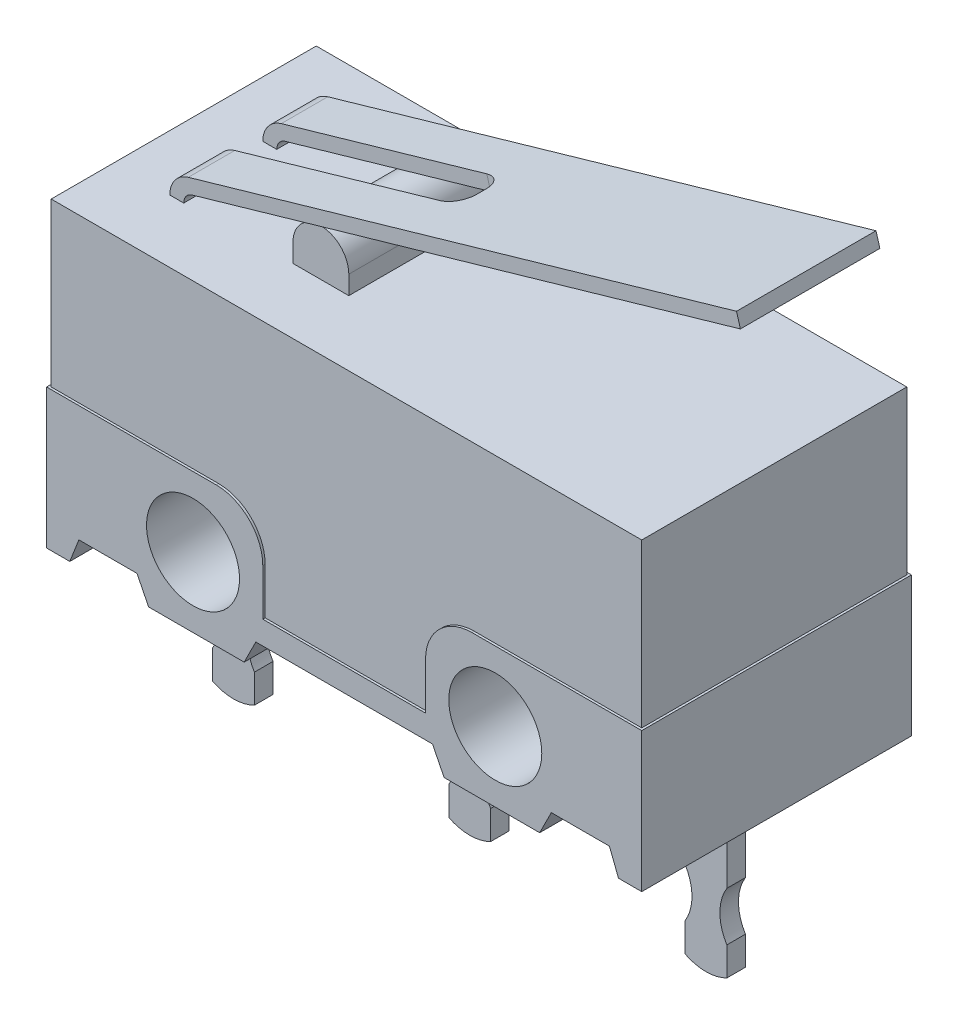
from build123d import *

# Parameters (mm, degrees)
SKETCH1_R             = 1
BOSS_EXTRUDE1_DEPTH   = 2.9
BOSS_EXTRUDE2_START   = -2.9
BOSS_EXTRUDE2_DEPTH   = 2.85
CUT_EXTRUDE1_DEPTH    = 10.97997996
BOSS_EXTRUDE3_DEPTH   = 0.2
BOSS_EXTRUDE3_2_DEPTH = 0.2
BOSS_EXTRUDE3_3_DEPTH = 0.2
BOSS_EXTRUDE4_START   = -2.85
BOSS_EXTRUDE4_DEPTH   = 1.45
BOSS_EXTRUDE5_START   = -2.85
BOSS_EXTRUDE5_DEPTH   = 1.5
CUT_EXTRUDE2_DEPTH    = 15.762153366


with BuildPart() as part:
    # Sketch1 → Boss-Extrude1 (new, symmetric)
    with BuildSketch(Plane.XY):
        with BuildLine():
            Line((6.4, -1.5), (-6.4, -1.5))
            Line((-6.4, -1.5), (-6.4, 1.5))
            Line((-6.4, 1.5), (-2.75, 1.5))
            ThreePointArc((-2.75, 1.5), (-2.042893219, 1.207106781), (-1.75, 0.5))
            Line((-1.75, 0.5), (-1.75, -0.5))
            Line((-1.75, -0.5), (1.75, -0.5))
            Line((1.75, -0.5), (1.75, 0.5))
            ThreePointArc((1.75, 0.5), (2.042893219, 1.207106781), (2.75, 1.5))
            Line((2.75, 1.5), (6.4, 1.5))
            Line((6.4, 1.5), (6.4, -1.5))
        make_face()
        with Locations((-3.25, 0)):
            Circle(SKETCH1_R, mode=Mode.SUBTRACT)
        with Locations((3.25, 0)):
            Circle(SKETCH1_R, mode=Mode.SUBTRACT)
    extrude(amount=BOSS_EXTRUDE1_DEPTH, both=True)

    # Sketch4 → Cut-Extrude1 (cut, through all)
    with BuildSketch(Plane.XY.offset(2.9)):
        Polygon((-5.9, -1.5), (-5.705, -1), (-4.455, -1), (-4.205, -1.5), align=None)
        Polygon((-2.15, -1.5), (-1.9, -1), (1.9, -1), (2.15, -1.5), align=None)
        Polygon((5.9, -1.5), (4.205, -1.5), (4.455, -1), (5.705, -1), align=None)
    extrude(amount=-CUT_EXTRUDE1_DEPTH, mode=Mode.SUBTRACT)


with BuildPart() as body_2:
    # Sketch3 → Boss-Extrude2 (new, symmetric)
    with BuildSketch(Plane.XY.offset(2.9).offset(BOSS_EXTRUDE2_START)):
        with BuildLine():
            Line((-3.25, 5), (-6.35, 5))
            Line((-6.35, 5), (-6.35, 1.5))
            Line((-6.35, 1.5), (-2.75, 1.5))
            ThreePointArc((-2.75, 1.5), (-2.042893219, 1.207106781), (-1.75, 0.5))
            Line((-1.75, 0.5), (-1.75, -0.5))
            Line((-1.75, -0.5), (1.75, -0.5))
            Line((1.75, -0.5), (1.75, 0.5))
            ThreePointArc((1.75, 0.5), (2.042893219, 1.207106781), (2.75, 1.5))
            Line((2.75, 1.5), (6.35, 1.5))
            Line((6.35, 1.5), (6.35, 5))
            Line((6.35, 5), (3.25, 5))
            Line((3.25, 5), (-3.25, 5))
        make_face()
    extrude(amount=BOSS_EXTRUDE2_DEPTH, both=True)


with BuildPart() as body_3:
    # Sketch5 → Boss-Extrude3 (new, symmetric)
    with BuildSketch(Plane.XY):
        with BuildLine():
            Line((-5.53, -1), (-5.53, -3.223217312))
            ThreePointArc((-5.53, -3.223217312), (-5.38, -3.75), (-5.53, -4.276782688))
            Line((-5.53, -4.276782688), (-5.53, -4.893028555))
            ThreePointArc((-5.53, -4.893028555), (-5.08, -5), (-4.63, -4.893028555))
            Line((-4.63, -4.893028555), (-4.63, -4.276782688))
            ThreePointArc((-4.63, -4.276782688), (-4.78, -3.75), (-4.63, -3.223217312))
            Line((-4.63, -3.223217312), (-4.63, -1))
            Line((-4.63, -1), (-5.08, -1))
            Line((-5.08, -1), (-5.53, -1))
        make_face()
    extrude(amount=BOSS_EXTRUDE3_DEPTH, both=True)


with BuildPart() as body_4:
    # Sketch5 → Boss-Extrude3 2 (new, symmetric)
    with BuildSketch(Plane.XY):
        with BuildLine():
            Line((-0.45, -4.276782688), (-0.45, -4.893028555))
            ThreePointArc((-0.45, -4.893028555), (0, -5), (0.45, -4.893028555))
            Line((0.45, -4.893028555), (0.45, -4.276782688))
            ThreePointArc((0.45, -4.276782688), (0.3, -3.75), (0.45, -3.223217312))
            Line((0.45, -3.223217312), (0.45, -1))
            Line((0.45, -1), (0, -1))
            Line((0, -1), (-0.45, -1))
            Line((-0.45, -1), (-0.45, -3.223217312))
            ThreePointArc((-0.45, -3.223217312), (-0.3, -3.75), (-0.45, -4.276782688))
        make_face()
    extrude(amount=BOSS_EXTRUDE3_2_DEPTH, both=True)


with BuildPart() as body_5:
    # Sketch5 → Boss-Extrude3 3 (new, symmetric)
    with BuildSketch(Plane.XY):
        with BuildLine():
            Line((5.53, -4.276782688), (5.53, -4.893028555))
            ThreePointArc((5.53, -4.893028555), (5.08, -5), (4.63, -4.893028555))
            Line((4.63, -4.893028555), (4.63, -4.276782688))
            ThreePointArc((4.63, -4.276782688), (4.78, -3.75), (4.63, -3.223217312))
            Line((4.63, -3.223217312), (4.63, -1))
            Line((4.63, -1), (5.08, -1))
            Line((5.08, -1), (5.53, -1))
            Line((5.53, -1), (5.53, -3.223217312))
            ThreePointArc((5.53, -3.223217312), (5.38, -3.75), (5.53, -4.276782688))
        make_face()
    extrude(amount=BOSS_EXTRUDE3_3_DEPTH, both=True)


with BuildPart() as body_6:
    # Sketch6 → Boss-Extrude4 (new, symmetric)
    with BuildSketch(Plane.XY.offset(2.85).offset(BOSS_EXTRUDE4_START)):
        with BuildLine():
            Line((-1.35, 5), (-2.55, 5))
            Line((-2.55, 5), (-2.55, 5.4))
            ThreePointArc((-2.55, 5.4), (-1.95, 6), (-1.35, 5.4))
            Line((-1.35, 5.4), (-1.35, 5))
        make_face()
    extrude(amount=BOSS_EXTRUDE4_DEPTH, both=True)


with BuildPart() as body_7:
    # Sketch7 → Boss-Extrude5 (new, symmetric)
    with BuildSketch(Plane.XY.offset(2.85).offset(BOSS_EXTRUDE5_START)):
        with BuildLine():
            Line((-4.669276938, 5.240209712), (7.121336657, 8.640645089))
            Line((7.121336657, 8.640645089), (7.038204331, 8.928896743))
            Line((7.038204331, 8.928896743), (-4.752409263, 5.528461367))
            ThreePointArc((-4.752409263, 5.528461367), (-5.039502614, 5.330662143), (-5.15, 5))
            Line((-5.15, 5), (-4.85, 5))
            ThreePointArc((-4.85, 5), (-4.799773915, 5.150300974), (-4.669276938, 5.240209712))
        make_face()
    extrude(amount=BOSS_EXTRUDE5_DEPTH, both=True)

    # Sketch8 → Cut-Extrude2 (cut, through all)
    with BuildSketch(Plane(origin=(-1.836916771, 6.369294945, 0), x_dir=(0.9608388493523414, 0.27710775083939576, 0), z_dir=(-0.2771077508393957, 0.9608388493523413, 0))):
        with BuildLine():
            Line((1.565680047, 0.5), (-3.034319953, 0.5))
            Line((-3.034319953, 0.5), (-4.534319953, 0.5))
            Line((-4.534319953, 0.5), (-4.534319953, -0.5))
            Line((-4.534319953, -0.5), (-3.034319953, -0.5))
            Line((-3.034319953, -0.5), (1.565680047, -0.5))
            ThreePointArc((1.565680047, -0.5), (1.84852276, -0.382842712), (1.965680047, -0.1))
            Line((1.965680047, -0.1), (1.965680047, 0))
            Line((1.965680047, 0), (1.965680047, 0.1))
            ThreePointArc((1.965680047, 0.1), (1.84852276, 0.382842712), (1.565680047, 0.5))
        make_face()
    extrude(amount=-CUT_EXTRUDE2_DEPTH, mode=Mode.SUBTRACT)


solid = Compound([part.part, body_2.part, body_3.part, body_4.part, body_5.part, body_6.part, body_7.part])
